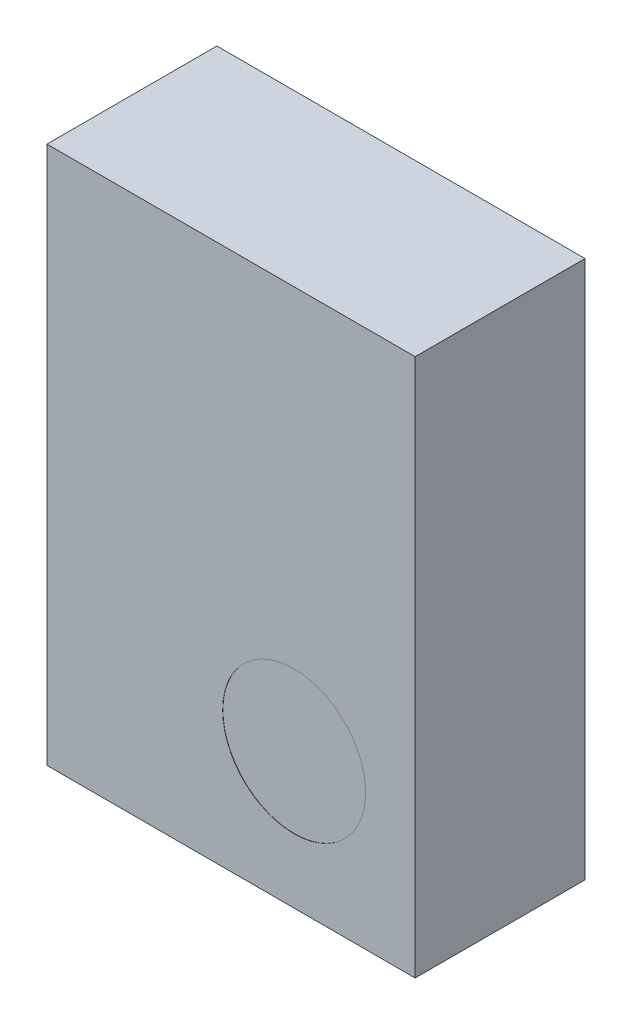
from build123d import *

# Parameters (mm, degrees)
SKETCH1_W           = 41.275
SKETCH1_H           = 19.05
BOSS_EXTRUDE1_DEPTH = 60.325
SKETCH2_R           = 8.012470392
CUT_EXTRUDE1_DEPTH  = 0.0254


with BuildPart() as part:
    # Sketch1 → Boss-Extrude1 (new body)
    with BuildSketch(Plane(origin=(0, 0, 0), x_dir=(1, 0, 0), z_dir=(0, 1, 0))):
        Rectangle(SKETCH1_W, SKETCH1_H)
    extrude(amount=BOSS_EXTRUDE1_DEPTH)

    # Sketch2 → Cut-Extrude1 (cut)
    with BuildSketch(Plane.XY.offset(9.525)):
        with Locations((7.073544027, 15.22702933)):
            Circle(SKETCH2_R)
    extrude(amount=-CUT_EXTRUDE1_DEPTH, mode=Mode.SUBTRACT)


solid = part.part
